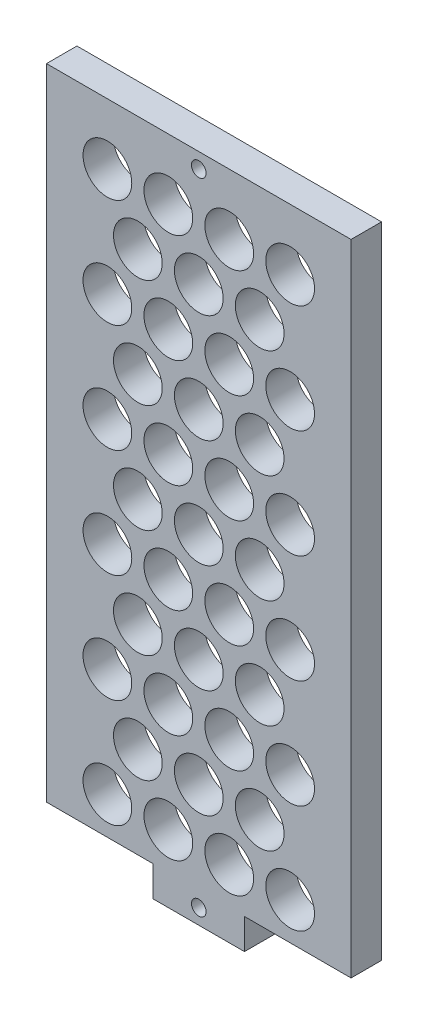
from build123d import *

# Parameters (mm, degrees)
SKETCH1_W           = 50.8
SKETCH1_H           = 127
BOSS_EXTRUDE1_DEPTH = 6.35
SKETCH2_R           = 5.08
CUT_EXTRUDE1_DEPTH  = 137.930502446
SKETCH3_W           = 19.05
SKETCH3_H           = 6.35
SKETCH3_R           = 1.524
BOSS_EXTRUDE2_DEPTH = 6.35
BOSS_EXTRUDE3_DEPTH = 6.35
SKETCH5_R           = 1.524
CUT_EXTRUDE2_DEPTH  = 146.219377151


with BuildPart() as part:
    # Sketch1 → Boss-Extrude1 (new body)
    with BuildSketch(Plane.XY):
        with Locations((25.4, 63.5)):
            Rectangle(SKETCH1_W, SKETCH1_H)
    extrude(amount=BOSS_EXTRUDE1_DEPTH)

    # Sketch2 → Cut-Extrude1 (cut, through all)
    with BuildSketch(Plane.XY.offset(6.35)):
        with Locations(Location((6.35, 98.072222222, 0), (0, 0, 180))):
            Circle(SKETCH2_R)
        with Locations(Location((19.05, 98.072222222, 0), (0, 0, 180))):
            Circle(SKETCH2_R)
        with Locations(Location((31.75, 98.072222222, 0), (0, 0, 180))):
            Circle(SKETCH2_R)
        with Locations(Location((44.45, 98.072222222, 0), (0, 0, 180))):
            Circle(SKETCH2_R)
        with Locations(Location((12.7, 86.783333333, 0), (0, 0, 180))):
            Circle(SKETCH2_R)
        with Locations(Location((25.4, 86.783333333, 0), (0, 0, 180))):
            Circle(SKETCH2_R)
        with Locations(Location((38.1, 86.783333333, 0), (0, 0, 180))):
            Circle(SKETCH2_R)
        with Locations(Location((44.45, 75.494444444, 0), (0, 0, 180))):
            Circle(SKETCH2_R)
        with Locations(Location((31.75, 75.494444444, 0), (0, 0, 180))):
            Circle(SKETCH2_R)
        with Locations(Location((19.05, 75.494444444, 0), (0, 0, 180))):
            Circle(SKETCH2_R)
        with Locations(Location((6.35, 75.494444444, 0), (0, 0, 180))):
            Circle(SKETCH2_R)
        with Locations(Location((6.35, 30.338888889, 0), (0, 0, 180))):
            Circle(SKETCH2_R)
        with Locations(Location((19.05, 30.338888889, 0), (0, 0, 180))):
            Circle(SKETCH2_R)
        with Locations(Location((31.75, 30.338888889, 0), (0, 0, 180))):
            Circle(SKETCH2_R)
        with Locations((19.05, 120.65)):
            Circle(SKETCH2_R)
        with Locations((6.35, 120.65)):
            Circle(SKETCH2_R)
        with Locations((31.75, 120.65)):
            Circle(SKETCH2_R)
        with Locations((44.45, 120.65)):
            Circle(SKETCH2_R)
        with Locations((25.4, 109.361111111)):
            Circle(SKETCH2_R)
        with Locations((38.1, 109.361111111)):
            Circle(SKETCH2_R)
        with Locations((12.7, 109.361111111)):
            Circle(SKETCH2_R)
        with Locations(Location((44.45, 30.338888889, 0), (0, 0, 180))):
            Circle(SKETCH2_R)
        with Locations(Location((38.1, 41.627777778, 0), (0, 0, 180))):
            Circle(SKETCH2_R)
        with Locations(Location((25.4, 41.627777778, 0), (0, 0, 180))):
            Circle(SKETCH2_R)
        with Locations(Location((12.7, 41.627777778, 0), (0, 0, 180))):
            Circle(SKETCH2_R)
        with Locations((38.1, 64.205555556)):
            Circle(SKETCH2_R)
        with Locations((25.4, 64.205555556)):
            Circle(SKETCH2_R)
        with Locations((12.7, 64.205555556)):
            Circle(SKETCH2_R)
        with Locations((44.45, 52.916666667)):
            Circle(SKETCH2_R)
        with Locations((31.75, 52.916666667)):
            Circle(SKETCH2_R)
        with Locations((19.05, 52.916666667)):
            Circle(SKETCH2_R)
        with Locations((6.35, 52.916666667)):
            Circle(SKETCH2_R)
        with Locations((12.7, 19.05)):
            Circle(SKETCH2_R)
        with Locations((25.4, 19.05)):
            Circle(SKETCH2_R)
        with Locations((38.1, 19.05)):
            Circle(SKETCH2_R)
        with Locations(Location((6.35, 7.761111111, 0), (0, 0, 180))):
            Circle(SKETCH2_R)
        with Locations(Location((19.05, 7.761111111, 0), (0, 0, 180))):
            Circle(SKETCH2_R)
        with Locations(Location((31.75, 7.761111111, 0), (0, 0, 180))):
            Circle(SKETCH2_R)
        with Locations(Location((44.45, 7.761111111, 0), (0, 0, 180))):
            Circle(SKETCH2_R)
    extrude(amount=-CUT_EXTRUDE1_DEPTH, mode=Mode.SUBTRACT)



with BuildPart() as body_2:
    # Sketch3 → Boss-Extrude2 (new body)
    with BuildSketch(Plane.XY.offset(6.35)):
        with Locations((25.4, -3.175)):
            Rectangle(SKETCH3_W, SKETCH3_H)
        with Locations((25.4, -3.175)):
            Circle(SKETCH3_R, mode=Mode.SUBTRACT)
    extrude(amount=-BOSS_EXTRUDE2_DEPTH)


with BuildPart() as part_1:
    add(part.part)

    add(body_2.part)  # Boss-Extrude3 merges body 2
    # Sketch4 → Boss-Extrude3 (add)
    with BuildSketch(Plane.XY.offset(6.35)):
        Polygon((50.8, 127), (50.8, 0), (57.15, 0), (57.15, 130.175), (57.15, 133.35), (-6.35, 133.35), (-6.35, 127), (-6.35, 0), (0, 0), (0, 127), align=None)
    extrude(amount=-BOSS_EXTRUDE3_DEPTH)

    # Sketch5 → Cut-Extrude2 (cut, through all)
    with BuildSketch(Plane.XY.offset(6.35)):
        with Locations((25.4, 130.175)):
            Circle(SKETCH5_R)
    extrude(amount=-CUT_EXTRUDE2_DEPTH, mode=Mode.SUBTRACT)


solid = part_1.part
